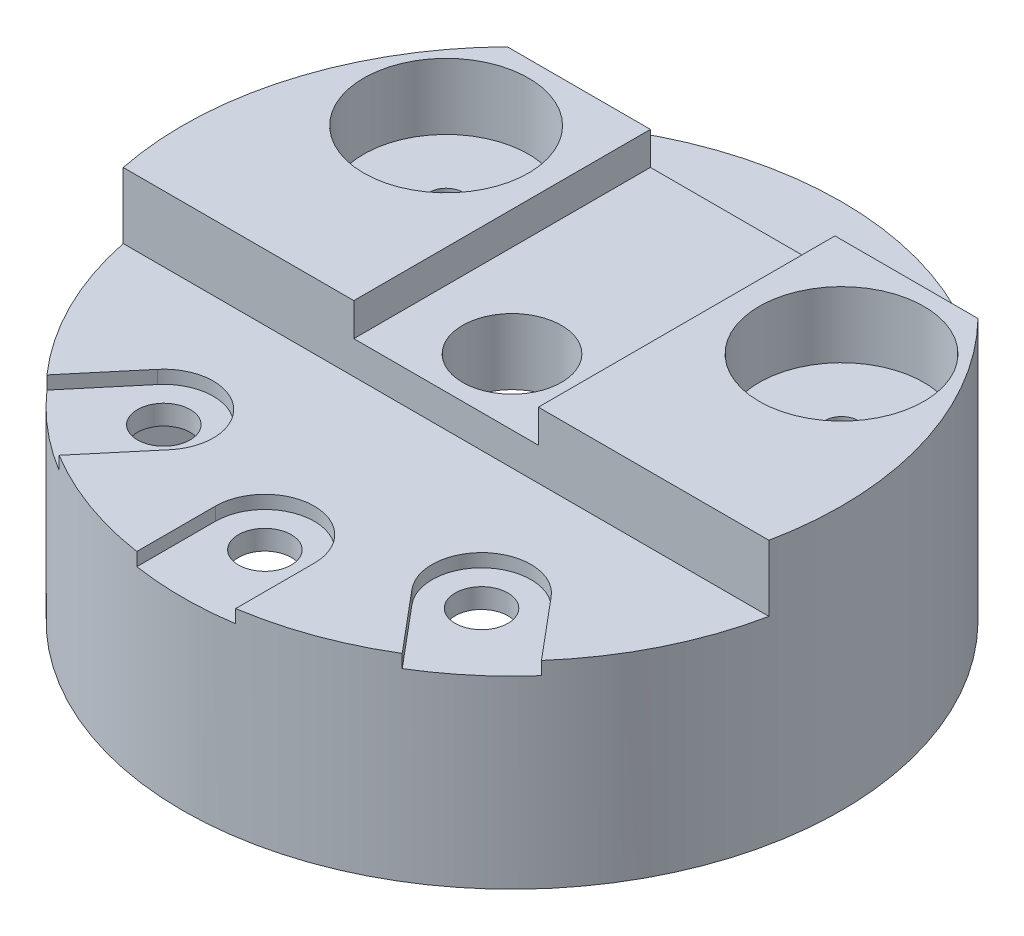
from build123d import *

# Parameters (mm, degrees)
SKETCH1_R           = 5
SKETCH1_R_2         = 4.75
BOSS_EXTRUDE1_DEPTH = 3
BOSS_EXTRUDE2_START = -0.5
SKETCH2_R           = 5
SKETCH2_R_2         = 0.75
BOSS_EXTRUDE2_DEPTH = 0.5
SKETCH3_R           = 0.75
SKETCH3_R_2         = 1.25
BOSS_EXTRUDE3_DEPTH = 1
SKETCH4_R           = 0.25
CUT_EXTRUDE1_DEPTH  = 0.5
SKETCH5_W           = 2.8
SKETCH5_H           = 4.5
CUT_EXTRUDE2_DEPTH  = 0.5
SKETCH6_R           = 0.4
CUT_EXTRUDE3_DEPTH  = 0.5
SKETCH7_R           = 0.4
CUT_EXTRUDE4_DEPTH  = 0.2


with BuildPart() as part:
    # Sketch1 → Boss-Extrude1 (new body)
    with BuildSketch(Plane(origin=(0, 0, 0), x_dir=(1, 0, 0), z_dir=(0, 1, 0))):
        with Locations(Location((0, 0, 0), (0, 0, 270))):
            Circle(SKETCH1_R)
        with Locations(Location((0, 0, 0), (0, 0, 270))):
            Circle(SKETCH1_R_2, mode=Mode.SUBTRACT)
    extrude(amount=BOSS_EXTRUDE1_DEPTH)

    # Sketch2 → Boss-Extrude2 (add)
    with BuildSketch(Plane(origin=(0, 3, 0), x_dir=(1, 0, 0), z_dir=(0, 1, 0)).offset(BOSS_EXTRUDE2_START)):
        with Locations(Location((0, 0, 0), (0, 0, 270))):
            Circle(SKETCH2_R)
        with Locations(Location((0, 0, 0), (0, 0, 270))):
            Circle(SKETCH2_R_2, mode=Mode.SUBTRACT)
    extrude(amount=BOSS_EXTRUDE2_DEPTH)

    # Sketch3 → Boss-Extrude3 (add)
    with BuildSketch(Plane(origin=(0, 3, 0), x_dir=(1, 0, 0), z_dir=(0, 1, 0))):
        with BuildLine():
            Line((-4.898979486, -1), (4.898979486, -1))
            ThreePointArc((4.898979486, -1), (4.795459086, 1.415475947), (3.570714214, 3.5))
            Line((3.570714214, 3.5), (-3.570714214, 3.5))
            ThreePointArc((-3.570714214, 3.5), (-4.795459086, 1.415475947), (-4.898979486, -1))
        make_face()
        with Locations(Location((0, 0, 0), (0, 0, 270))):
            Circle(SKETCH3_R, mode=Mode.SUBTRACT)
        with Locations(Location((3, 2, 0), (0, 0, 270))):
            Circle(SKETCH3_R_2, mode=Mode.SUBTRACT)
        with Locations(Location((-3, 2, 0), (0, 0, 270))):
            Circle(SKETCH3_R_2, mode=Mode.SUBTRACT)
    extrude(amount=BOSS_EXTRUDE3_DEPTH)

    # Sketch4 → Cut-Extrude1 (cut)
    with BuildSketch(Plane(origin=(0, 3, 0), x_dir=(1, 0, 0), z_dir=(0, 1, 0))):
        with Locations(Location((-3, 2, 0), (0, 0, 270))):
            Circle(SKETCH4_R)
        with Locations(Location((3, 2, 0), (0, 0, 270))):
            Circle(SKETCH4_R)
    extrude(amount=-CUT_EXTRUDE1_DEPTH, mode=Mode.SUBTRACT)

    # Sketch5 → Cut-Extrude2 (cut)
    with BuildSketch(Plane(origin=(0, 4, 0), x_dir=(1, 0, 0), z_dir=(0, 1, 0))):
        with Locations((0, 1.25)):
            Rectangle(SKETCH5_W, SKETCH5_H)
    extrude(amount=-CUT_EXTRUDE2_DEPTH, mode=Mode.SUBTRACT)

    # Sketch6 → Cut-Extrude3 (cut)
    with BuildSketch(Plane(origin=(0, 3, 0), x_dir=(1, 0, 0), z_dir=(0, 1, 0))):
        with Locations(Location((0, -3.75, 0), (0, 0, 270))):
            Circle(SKETCH6_R)
        with Locations(Location((2.410453536, -2.872666662, 0), (0, 0, 270))):
            Circle(SKETCH6_R)
        with Locations(Location((-2.410453536, -2.872666662, 0), (0, 0, 270))):
            Circle(SKETCH6_R)
    extrude(amount=-CUT_EXTRUDE3_DEPTH, mode=Mode.SUBTRACT)

    # Sketch7 → Cut-Extrude4 (cut)
    # profile 1 of 3: a face of its own
    with BuildSketch(Plane(origin=(0, 3, 0), x_dir=(1, 0, 0), z_dir=(0, 1, 0))):
        with BuildLine():
            Line((-0.75, -3.75), (-0.75, -5.45))
            Line((-0.75, -5.45), (0.75, -5.45))
            Line((0.75, -5.45), (0.75, -3.75))
            ThreePointArc((0.75, -3.75), (0, -3), (-0.75, -3.75))
        make_face()
        with Locations(Location((0, -3.75, 0), (0, 0, 270))):
            Circle(SKETCH7_R, mode=Mode.SUBTRACT)
    # profile 2 of 3: a face of its own
    with BuildSketch(Plane(origin=(0, 3, 0), x_dir=(1, 0, 0), z_dir=(0, 1, 0))):
        with BuildLine():
            Line((-2.92865914, -4.657032922), (-1.835920204, -3.354757369))
            ThreePointArc((-1.835920204, -3.354757369), (-1.928362829, -2.298133329), (-2.984986869, -2.390575954))
            Line((-2.984986869, -2.390575954), (-4.077725805, -3.692851508))
            Line((-4.077725805, -3.692851508), (-2.92865914, -4.657032922))
        make_face()
        with Locations(Location((-2.410453536, -2.872666662, 0), (0, 0, 270))):
            Circle(SKETCH7_R, mode=Mode.SUBTRACT)
    # profile 3 of 3: a face of its own
    with BuildSketch(Plane(origin=(0, 3, 0), x_dir=(1, 0, 0), z_dir=(0, 1, 0))):
        with BuildLine():
            Line((2.984986869, -2.390575954), (4.077725805, -3.692851508))
            Line((4.077725805, -3.692851508), (2.92865914, -4.657032922))
            Line((2.92865914, -4.657032922), (1.835920204, -3.354757369))
            ThreePointArc((1.835920204, -3.354757369), (1.928362829, -2.298133329), (2.984986869, -2.390575954))
        make_face()
        with Locations(Location((2.410453536, -2.872666662, 0), (0, 0, 270))):
            Circle(SKETCH7_R, mode=Mode.SUBTRACT)
    extrude(amount=-CUT_EXTRUDE4_DEPTH, mode=Mode.SUBTRACT)


solid = part.part
